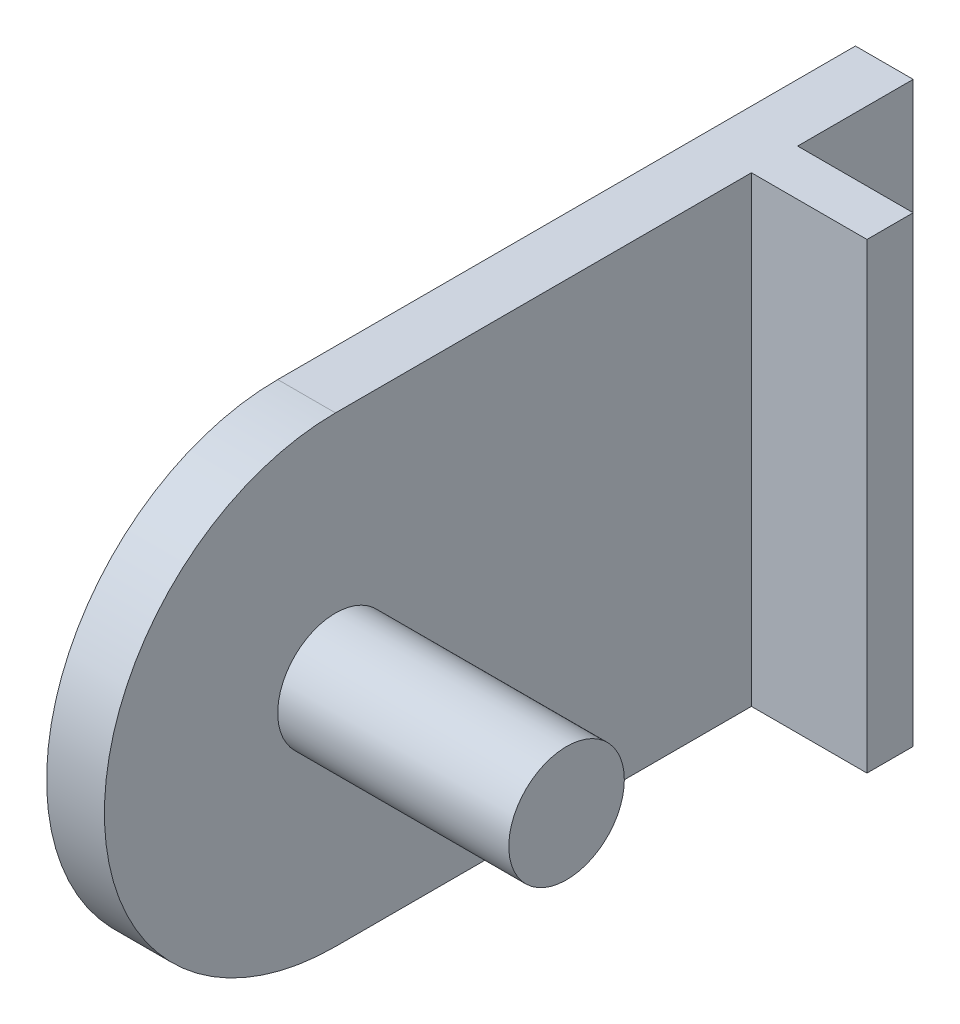
from build123d import *

# Parameters (mm, degrees)
BOSS_EXTRUDE1_DEPTH = 5
SKETCH2_W           = 40
SKETCH2_H           = 4
BOSS_EXTRUDE2_DEPTH = 10
SKETCH3_R           = 5
BOSS_EXTRUDE3_DEPTH = 20


with BuildPart() as part:
    # Sketch1 → Boss-Extrude1 (new body)
    with BuildSketch(Plane.YZ):
        with BuildLine():
            Line((20, 0), (20, -50))
            Line((20, -50), (-20, -50))
            Line((-20, -50), (-20, 0))
            ThreePointArc((-20, 0), (0, 20), (20, 0))
        make_face()
    extrude(amount=BOSS_EXTRUDE1_DEPTH)

    # Sketch2 → Boss-Extrude2 (add)
    with BuildSketch(Plane.YZ.offset(5)):
        with Locations((0, -38)):
            Rectangle(SKETCH2_W, SKETCH2_H)
    extrude(amount=BOSS_EXTRUDE2_DEPTH)

    # Sketch3 → Boss-Extrude3 (add)
    with BuildSketch(Plane.YZ.offset(5)):
        with Locations(Location((0, 0, 0), (0, 0, 270))):
            Circle(SKETCH3_R)
    extrude(amount=BOSS_EXTRUDE3_DEPTH)


solid = part.part
